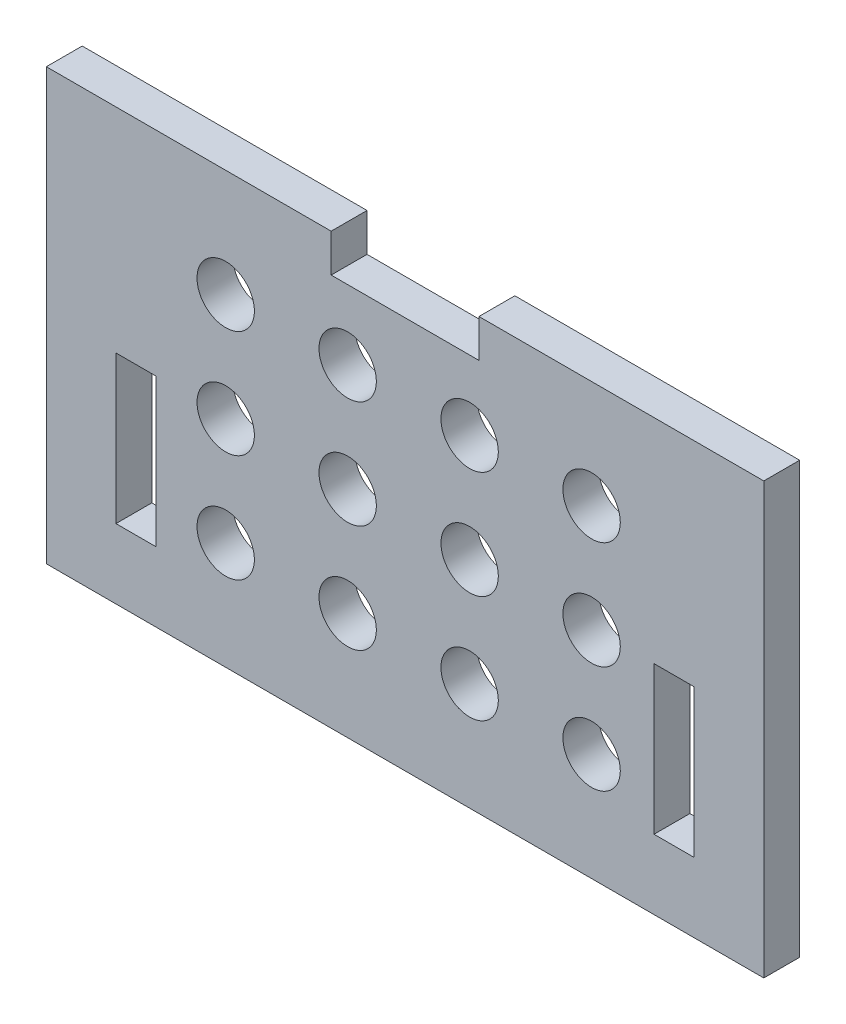
from build123d import *

# Parameters (mm, degrees)
SKETCH1_R           = 4
SKETCH1_W           = 5.6
SKETCH1_H           = 20.6
BOSS_EXTRUDE1_DEPTH = 5


with BuildPart() as part:
    # Sketch1 → Boss-Extrude1 (new body)
    with BuildSketch(Plane.XY):
        Polygon((0, 0), (100, 0), (100, 60), (60.3, 60), (60.3, 54.7), (39.7, 54.7), (39.7, 60), (0, 60), align=None)
        with Locations((25, 45)):
            Circle(SKETCH1_R, mode=Mode.SUBTRACT)
        with Locations((42, 45)):
            Circle(SKETCH1_R, mode=Mode.SUBTRACT)
        with Locations((59, 45)):
            Circle(SKETCH1_R, mode=Mode.SUBTRACT)
        with Locations((76, 45)):
            Circle(SKETCH1_R, mode=Mode.SUBTRACT)
        with Locations((42, 30)):
            Circle(SKETCH1_R, mode=Mode.SUBTRACT)
        with Locations((59, 30)):
            Circle(SKETCH1_R, mode=Mode.SUBTRACT)
        with Locations((76, 30)):
            Circle(SKETCH1_R, mode=Mode.SUBTRACT)
        with Locations((42, 15)):
            Circle(SKETCH1_R, mode=Mode.SUBTRACT)
        with Locations((59, 15)):
            Circle(SKETCH1_R, mode=Mode.SUBTRACT)
        with Locations((76, 15)):
            Circle(SKETCH1_R, mode=Mode.SUBTRACT)
        with Locations((25, 30)):
            Circle(SKETCH1_R, mode=Mode.SUBTRACT)
        with Locations((25, 15)):
            Circle(SKETCH1_R, mode=Mode.SUBTRACT)
        with Locations((12.5, 20)):
            Rectangle(SKETCH1_W, SKETCH1_H, mode=Mode.SUBTRACT)
        with Locations((87.5, 20)):
            Rectangle(SKETCH1_W, SKETCH1_H, mode=Mode.SUBTRACT)
    extrude(amount=BOSS_EXTRUDE1_DEPTH)


solid = part.part
